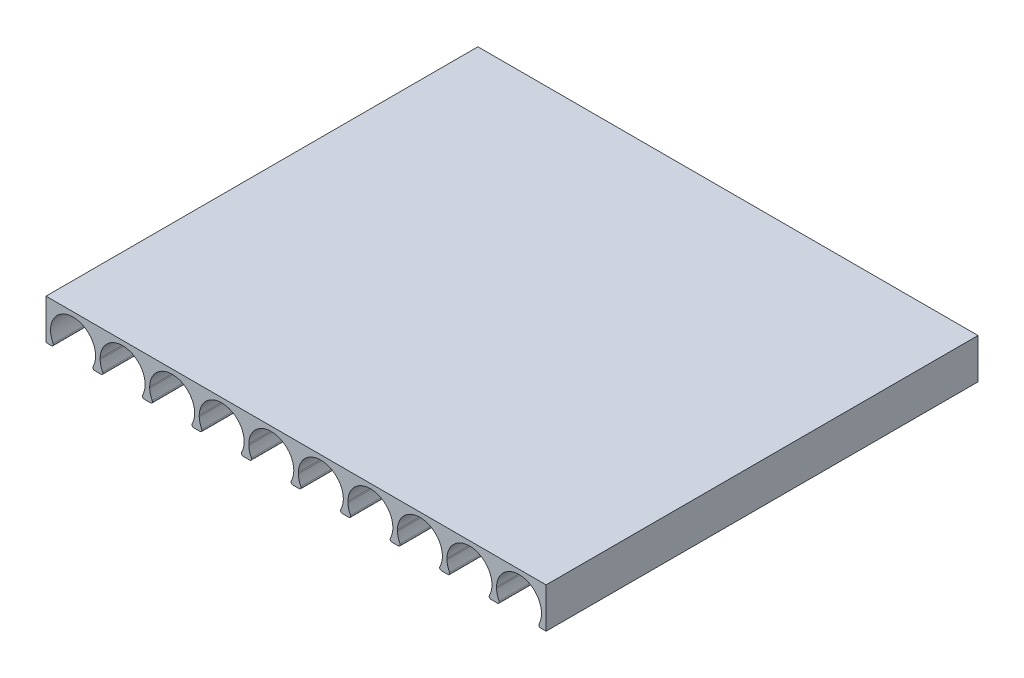
from build123d import *

# Parameters (mm, degrees)
BOSS_EXTRUDE1_DEPTH    = 30
FILLET1_R              = 0.254
LPATTERN1_COUNT        = 10
LPATTERN1_PITCH        = 6.8834
FILLET1_OF_LPATTERN1_R = 0.254


with BuildPart() as part:
    # Sketch1 → Boss-Extrude1 (new, symmetric)
    with BuildSketch(Plane.XY):
        with BuildLine():
            Line((0, 0), (1.22, 0))
            ThreePointArc((1.22, 0), (3.76, 4.945446374), (6.3, 0))
            Line((6.3, 0), (7.52, 0))
            Line((7.52, 0), (7.52, 5.580446374))
            Line((7.52, 5.580446374), (0, 5.580446374))
            Line((0, 5.580446374), (0, 0))
        make_face()
    boss_extrude1 = extrude(amount=BOSS_EXTRUDE1_DEPTH, both=True)

    # Fillet1
    fillet1_edges = [part.edges().sort_by_distance(p)[0] for p in [
        (6.3, 0, 0),
        (1.22, 0, 0),
    ]]
    fillet(fillet1_edges, radius=FILLET1_R)

    # LPattern1: Boss-Extrude1 ×10
    with Locations(*[(-i * LPATTERN1_PITCH, 0, 0) for i in range(1, LPATTERN1_COUNT)]):
        add(boss_extrude1)

    # Fillet1 of LPattern1
    fillet1_of_lpattern1_edges = [part.edges().sort_by_distance(p)[0] for p in [
        (-0.5834, 0, 0),
        (-5.6634, 0, 0),
        (-7.4668, 0, 0),
        (-12.5468, 0, 0),
        (-14.3502, 0, 0),
        (-19.4302, 0, 0),
        (-21.2336, 0, 0),
        (-26.3136, 0, 0),
        (-28.117, 0, 0),
        (-33.197, 0, 0),
        (-35.0004, 0, 0),
        (-40.0804, 0, 0),
        (-41.8838, 0, 0),
        (-46.9638, 0, 0),
        (-48.7672, 0, 0),
        (-53.8472, 0, 0),
        (-55.6506, 0, 0),
        (-60.7306, 0, 0),
    ]]
    fillet(fillet1_of_lpattern1_edges, radius=FILLET1_OF_LPATTERN1_R)


solid = part.part
